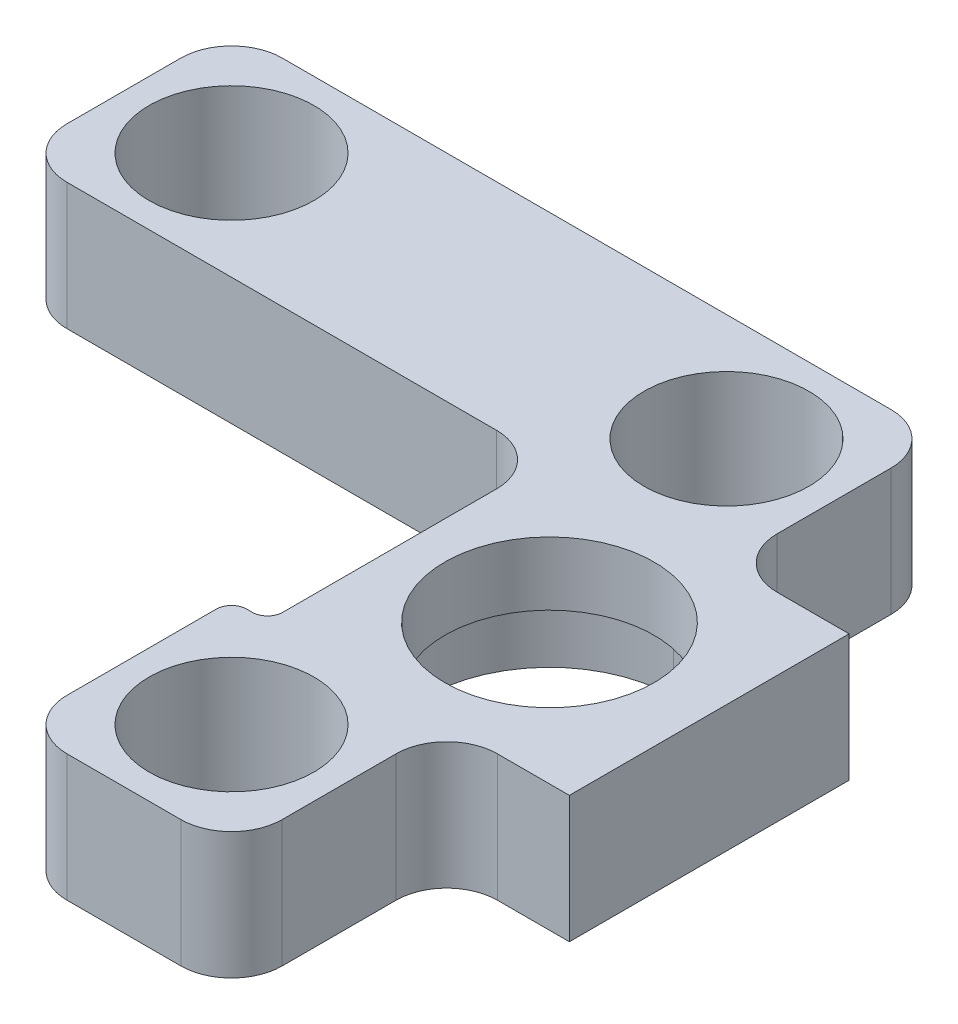
from build123d import *

# Parameters (mm, degrees)
SKETCH1_R           = 3.25
BOSS_EXTRUDE4_DEPTH = 2.5
BOSS_EXTRUDE5_START = 2.5
SKETCH1_3_R         = 3.25
SKETCH1_3_R_2       = 4.025
BOSS_EXTRUDE5_DEPTH = 2.5
SKETCH3_R           = 4.125
CUT_EXTRUDE1_DEPTH  = 24.60217151
FILLET1_R           = 0.6
FILLET2_R           = 2


with BuildPart() as part:
    # Sketch1 → Boss-Extrude4 (new body)
    with BuildSketch(Plane(origin=(0, 60.990384594, 0), x_dir=(1, 0, 0), z_dir=(0, 1, 0))):
        Polygon((3.58528137, 4.314718626), (-17.35, 4.314718626), (-17.35, 12.8), (10.65, 12.8), (10.65, 4.314718626), (15.48528137, 4.314718626), (15.48528137, -6.714718626), (10.65, -6.714718626), (10.65, -15.2), (2.164718626, -15.2), (2.164718626, -6.714718626), (3.58528137, -6.714718626), align=None)
        with Locations((6.407359313, -10.957359313)):
            Circle(SKETCH1_R, mode=Mode.SUBTRACT)
        with Locations((-13.107359313, 8.557359313)):
            Circle(SKETCH1_R, mode=Mode.SUBTRACT)
        with Locations((6.407359313, 8.557359313)):
            Circle(SKETCH1_R, mode=Mode.SUBTRACT)
        with BuildLine():
            Line((14.78528137, 3.7), (9.18528137, 3.7))
            ThreePointArc((9.18528137, 3.7), (4.28528137, -1.2), (9.18528137, -6.1))
            Line((9.18528137, -6.1), (14.78528137, -6.1))
            Line((14.78528137, -6.1), (14.78528137, 3.7))
        make_face(mode=Mode.SUBTRACT)
    extrude(amount=-BOSS_EXTRUDE4_DEPTH)

    # Sketch1<3> → Boss-Extrude5 (add)
    with BuildSketch(Plane(origin=(0, 60.990384594, 0), x_dir=(1, 0, 0), z_dir=(0, 1, 0)).offset(BOSS_EXTRUDE5_START)):
        Polygon((-17.35, 4.314718626), (3.58528137, 4.314718626), (3.58528137, -6.714718626), (2.164718626, -6.714718626), (2.164718626, -15.2), (10.65, -15.2), (10.65, -6.714718626), (15.48528137, -6.714718626), (15.48528137, 4.314718626), (10.65, 4.314718626), (10.65, 12.8), (-17.35, 12.8), align=None)
        with Locations((6.407359313, -10.957359313)):
            Circle(SKETCH1_3_R, mode=Mode.SUBTRACT)
        with Locations((-13.107359313, 8.557359313)):
            Circle(SKETCH1_3_R, mode=Mode.SUBTRACT)
        with Locations((6.407359313, 8.557359313)):
            Circle(SKETCH1_3_R, mode=Mode.SUBTRACT)
        with Locations((9.18528137, -1.2)):
            Circle(SKETCH1_3_R_2, mode=Mode.SUBTRACT)
    extrude(amount=-BOSS_EXTRUDE5_DEPTH)

    # Sketch3 → Cut-Extrude1 (cut, through all)
    with BuildSketch(Plane(origin=(0, 63.490384594, 0), x_dir=(1, 0, 0), z_dir=(0, 1, 0))):
        with Locations((9.18528137, -1.2)):
            Circle(SKETCH3_R)
    extrude(amount=-CUT_EXTRUDE1_DEPTH, mode=Mode.SUBTRACT)

    # Fillet1
    fillet1_edges = [part.edges().sort_by_distance(p)[0] for p in [
        (2.164718626, 60.990384594, 6.714718626),
        (3.58528137, 60.990384594, 6.714718626),
    ]]
    fillet(fillet1_edges, radius=FILLET1_R)

    # Fillet2
    fillet2_edges = [part.edges().sort_by_distance(p)[0] for p in [
        (3.58528137, 60.990384594, -4.314718626),
        (-17.35, 60.990384594, -12.8),
        (-17.35, 60.990384594, -4.314718626),
        (10.65, 60.990384594, -12.8),
        (10.65, 60.990384594, -4.314718626),
        (10.65, 60.990384594, 6.714718626),
        (10.65, 60.990384594, 15.2),
        (2.164718626, 60.990384594, 15.2),
    ]]
    fillet(fillet2_edges, radius=FILLET2_R)


solid = part.part
